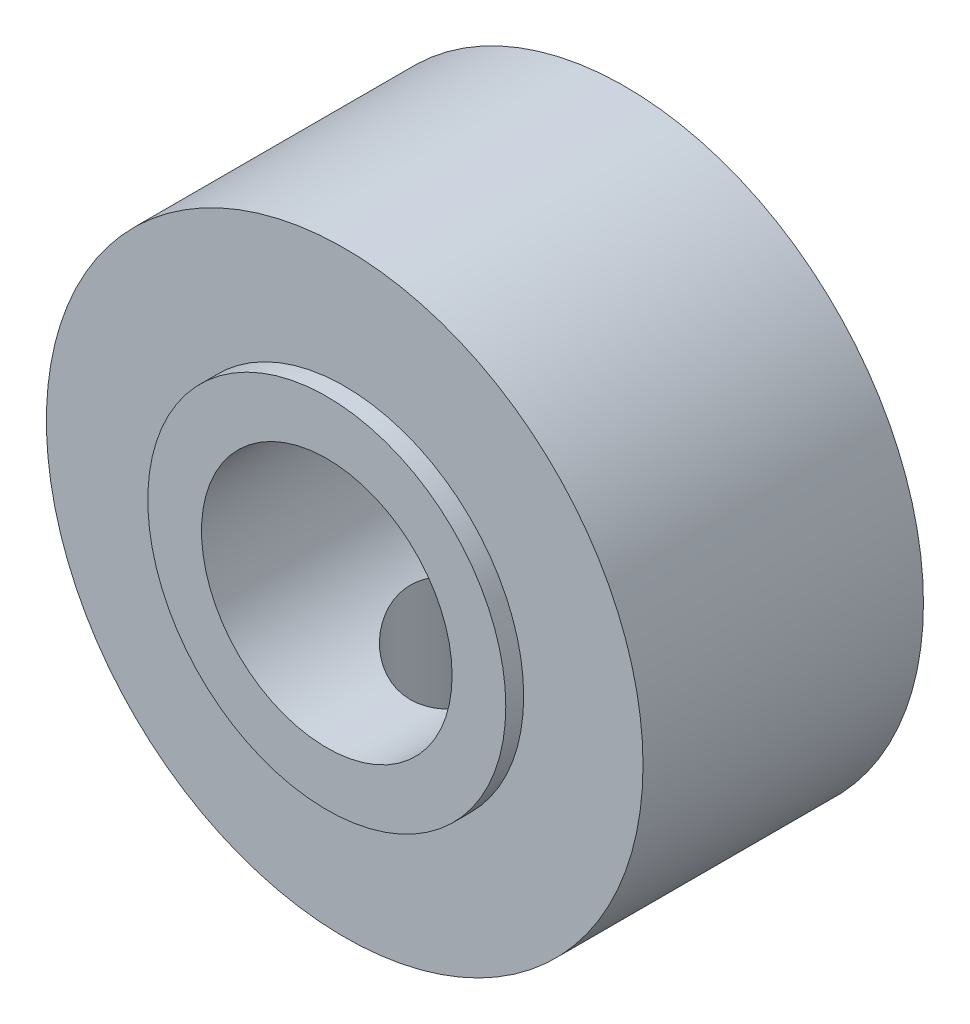
from build123d import *

# Parameters (mm, degrees)
ESQUISSE1_R             = 5
BOSS_EXTRU_1_DEPTH      = 4.7
ESQUISSE2_R             = 3
BOSS_EXTRU_3_DEPTH      = 0.3
ESQUISSE3_R             = 2.1
ENL_V_MAT_EXTRU_1_DEPTH = 9.660254038
ESQUISSE4_R             = 1.25
ENL_V_MAT_EXTRU_2_DEPTH = 9.660254038


with BuildPart() as part:
    # Esquisse1 → Boss.-Extru.1 (new body)
    with BuildSketch(Plane.XY):
        Circle(ESQUISSE1_R)
    extrude(amount=BOSS_EXTRU_1_DEPTH)

    # Esquisse2 → Boss.-Extru.3 (add)
    with BuildSketch(Plane.XY.offset(4.7)):
        Circle(ESQUISSE2_R)
    extrude(amount=BOSS_EXTRU_3_DEPTH)

    # Esquisse3 → Enlèv. mat.-Extru.1 (cut, through all)
    with BuildSketch(Plane.XY.offset(5)):
        Circle(ESQUISSE3_R)
    extrude(amount=-ENL_V_MAT_EXTRU_1_DEPTH, mode=Mode.SUBTRACT)

    # Esquisse4 → Enlèv. mat.-Extru.2 (cut, through all)
    with BuildSketch(Plane(origin=(0, 0, 0), x_dir=(1, 0, 0), z_dir=(0, 1, 0))):
        with Locations(Location((0, -2.35, 0), (0, 0, 270))):
            Circle(ESQUISSE4_R)
    extrude(amount=-ENL_V_MAT_EXTRU_2_DEPTH, mode=Mode.SUBTRACT)


solid = part.part
